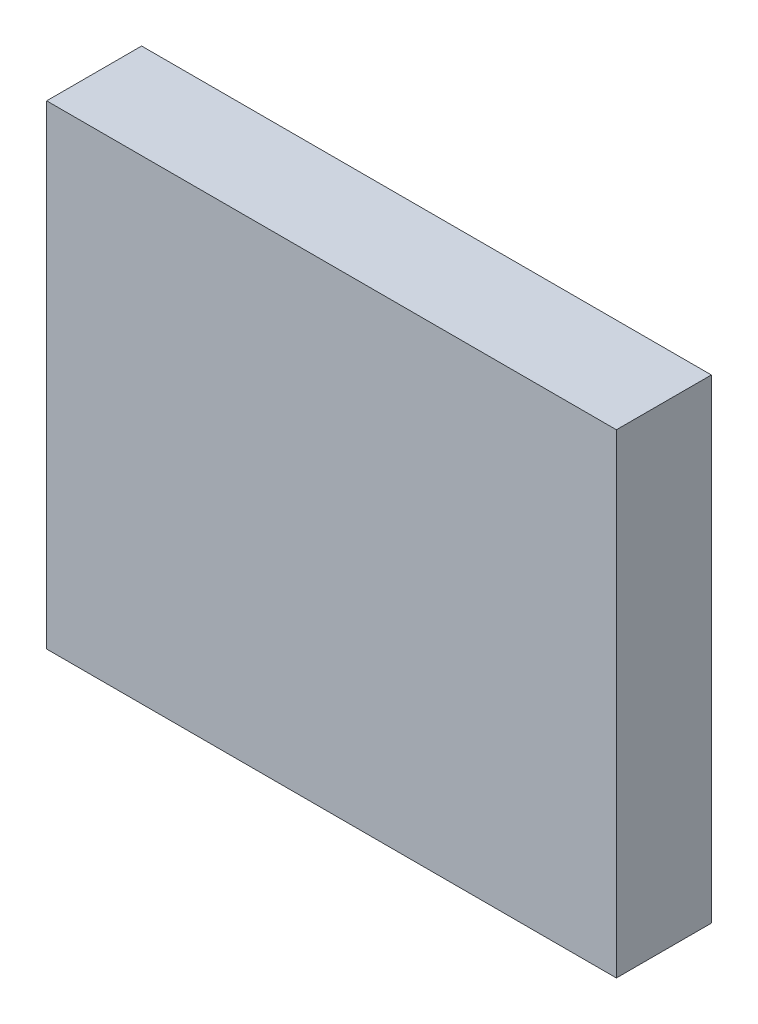
from build123d import *

# Parameters (mm, degrees)
SKETCH_1_W          = 120
SKETCH_1_H          = 100
EXTRUDE_1_DEPTH     = 20
SKETCH_1_3_R        = 12.5
CUT_EXTRUDE_2_DEPTH = 10


with BuildPart() as part:
    # 草图1 → 凸台-拉伸1 (new body)
    with BuildSketch(Plane.XY):
        Rectangle(SKETCH_1_W, SKETCH_1_H)
    extrude(amount=EXTRUDE_1_DEPTH)

    # 草图1<3> → 切除-拉伸2 (cut)
    with BuildSketch(Plane.XY):
        Circle(SKETCH_1_3_R)
        with BuildLine():
            Line((-30, -22), (30, -22))
            ThreePointArc((30, -22), (38, -30), (30, -38))
            Line((30, -38), (-30, -38))
            ThreePointArc((-30, -38), (-38, -30), (-30, -22))
        make_face()
    extrude(amount=CUT_EXTRUDE_2_DEPTH, mode=Mode.SUBTRACT)


solid = part.part
